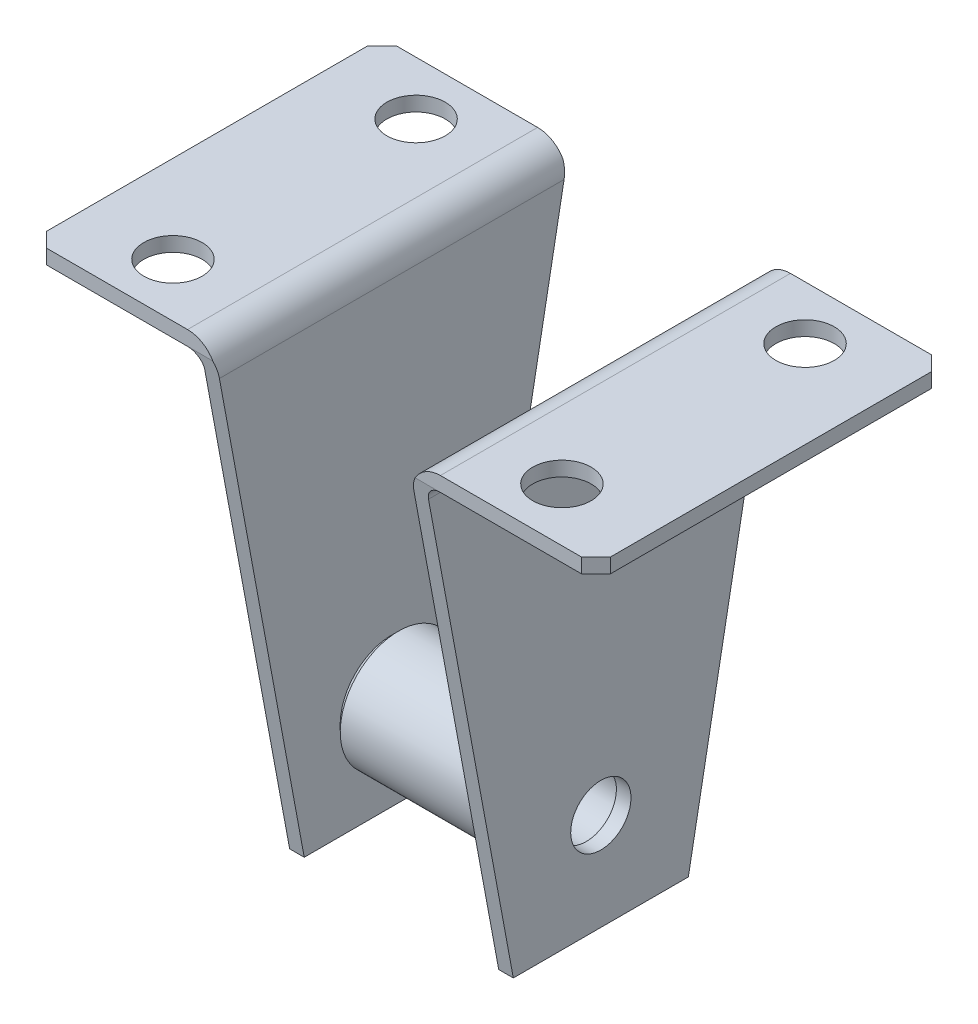
from build123d import *

# Parameters (mm, degrees)
BOSS_EXTRUDE1_DEPTH     = 18
BOSS_EXTRUDE1_2_DEPTH   = 18
CUT_EXTRUDE1_DEPTH      = 61.539243471
CUT_EXTRUDE1_DEPTH_BACK = 61.539243471
SKETCH3_R               = 3.1
CUT_EXTRUDE2_DEPTH      = 67.815043216
SKETCH5_R               = 3
CUT_EXTRUDE3_DEPTH      = 61.539243471
CHAMFER1_SIZE           = 1.5


with BuildPart() as part:
    # Sketch1 → Boss-Extrude1 (new, symmetric)
    with BuildSketch(Plane.XY):
        with BuildLine():
            Line((-13, 0), (-29, 0))
            Line((-29, 0), (-29, -1.5))
            Line((-29, -1.5), (-13, -1.5))
            ThreePointArc((-13, -1.5), (-11.939339828, -1.939339828), (-11.5, -3))
            Line((-11.5, -3), (-11.5, -50))
            Line((-11.5, -50), (-10, -50))
            Line((-10, -50), (-10, -3))
            ThreePointArc((-10, -3), (-10.878679656, -0.878679656), (-13, 0))
        make_face()
    extrude(amount=BOSS_EXTRUDE1_DEPTH, both=True)


with BuildPart() as body_2:
    # Sketch1 → Boss-Extrude1 2 (new, symmetric)
    with BuildSketch(Plane.XY):
        with BuildLine():
            Line((11.5, -50), (10, -50))
            Line((10, -50), (10, -3))
            ThreePointArc((10, -3), (10.878679656, -0.878679656), (13, 0))
            Line((13, 0), (29, 0))
            Line((29, 0), (29, -1.5))
            Line((29, -1.5), (13, -1.5))
            ThreePointArc((13, -1.5), (11.939339828, -1.939339828), (11.5, -3))
            Line((11.5, -3), (11.5, -50))
        make_face()
    extrude(amount=BOSS_EXTRUDE1_2_DEPTH, both=True)


with BuildPart() as cut_extrude1_tool:
    # Sketch2 → Cut-Extrude1 (new, two sides: drawn at the far end of the back side and taken through both)
    with BuildSketch(Plane(origin=(0, 0, 0), x_dir=(0, 0, -1), z_dir=(1, 0, 0)).offset(-CUT_EXTRUDE1_DEPTH_BACK)):
        Polygon((-18, -50), (-9, -50), (-18, -1.5), align=None)
        Polygon((9, -50), (18, -50), (18, -1.5), align=None)
    extrude(amount=CUT_EXTRUDE1_DEPTH + CUT_EXTRUDE1_DEPTH_BACK)


with BuildPart() as part_1:
    add(part.part)

    # Cut-Extrude1: cut by cut_extrude1_tool
    add(cut_extrude1_tool.part, mode=Mode.SUBTRACT)


with BuildPart() as body_2_1:
    add(body_2.part)

    # Cut-Extrude1: cut by cut_extrude1_tool
    add(cut_extrude1_tool.part, mode=Mode.SUBTRACT)


with BuildPart() as cut_extrude2_tool:
    # Sketch3 → Cut-Extrude2 (new, through all)
    with BuildSketch(Plane(origin=(11.5, 0, 0), x_dir=(0, 0, -1), z_dir=(1, 0, 0))):
        with Locations(Location((0, -40, 0), (0, 0, 90))):
            Circle(SKETCH3_R)
    extrude(amount=-CUT_EXTRUDE2_DEPTH)


with BuildPart() as part_2:
    add(part_1.part)

    # Cut-Extrude2: cut by cut_extrude2_tool
    add(cut_extrude2_tool.part, mode=Mode.SUBTRACT)



with BuildPart() as body_2_2:
    add(body_2_1.part)

    # Cut-Extrude2: cut by cut_extrude2_tool
    add(cut_extrude2_tool.part, mode=Mode.SUBTRACT)


with BuildPart() as part_3:
    add(part_2.part)

    add(body_2_2.part)  # Revolve1 merges body 2
    # Sketch4 → Revolve1 (revolve)
    with BuildSketch(Plane.XY, mode=Mode.PRIVATE) as revolve1_sk:
        Polygon((-10, -36.75), (10, -36.75), (10, -34.7), (9.3, -34), (-9.3, -34), (-10, -34.7), align=None)
    revolve(revolve1_sk.sketch.rotate(Axis((-10, -40, 0), (1, 0, 0)), 180), axis=Axis((-10, -40, 0), (1, 0, 0)))

    # Sketch5 → Cut-Extrude3 (cut, through all)
    with BuildSketch(Plane(origin=(0, 0, 0), x_dir=(1, 0, 0), z_dir=(0, 1, 0))):
        with Locations(Location((-20, 12.5, 0), (0, 0, 180))):
            Circle(SKETCH5_R)
        with Locations(Location((-20, -12.5, 0), (0, 0, 180))):
            Circle(SKETCH5_R)
        with Locations(Location((20, 12.5, 0), (0, 0, 180))):
            Circle(SKETCH5_R)
        with Locations(Location((20, -12.5, 0), (0, 0, 180))):
            Circle(SKETCH5_R)
    extrude(amount=-CUT_EXTRUDE3_DEPTH, mode=Mode.SUBTRACT)

    # Chamfer1
    chamfer1_edges = [part_3.edges().sort_by_distance(p)[0] for p in [
        (-29, -0.75, 18),
        (29, -0.75, -18),
        (29, -0.75, 18),
        (-29, -0.75, -18),
    ]]
    chamfer(chamfer1_edges, length=CHAMFER1_SIZE)


solid = part_3.part
